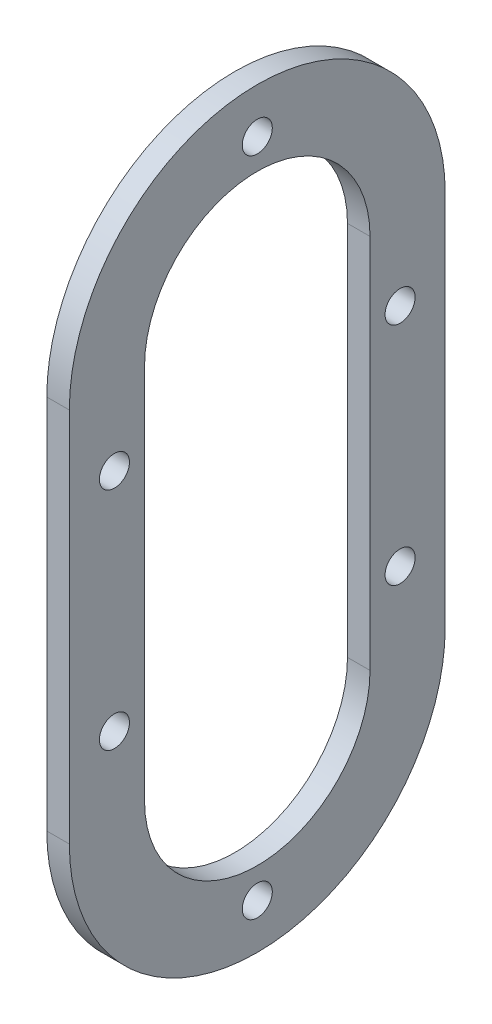
from build123d import *

# Parameters (mm, degrees)
SKETCH1_R           = 2
BOSS_EXTRUDE1_DEPTH = 3


with BuildPart() as part:
    # Sketch1 → Boss-Extrude1 (new body)
    with BuildSketch(Plane.YZ):
        with BuildLine():
            Line((0, 25), (50, 25))
            ThreePointArc((50, 25), (75, 0), (50, -25))
            Line((50, -25), (0, -25))
            ThreePointArc((0, -25), (-25, 0), (0, 25))
        make_face()
        with Locations(Location((10, 19, 0), (0, 0, 270))):
            Circle(SKETCH1_R, mode=Mode.SUBTRACT)
        with Locations(Location((40, 19, 0), (0, 0, 270))):
            Circle(SKETCH1_R, mode=Mode.SUBTRACT)
        with Locations(Location((69, 0, 0), (0, 0, 270))):
            Circle(SKETCH1_R, mode=Mode.SUBTRACT)
        with Locations(Location((-19, 0, 0), (0, 0, 270))):
            Circle(SKETCH1_R, mode=Mode.SUBTRACT)
        with Locations(Location((10, -19, 0), (0, 0, 270))):
            Circle(SKETCH1_R, mode=Mode.SUBTRACT)
        with Locations(Location((40, -19, 0), (0, 0, 270))):
            Circle(SKETCH1_R, mode=Mode.SUBTRACT)
        with BuildLine():
            Line((0, 15), (50, 15))
            ThreePointArc((50, 15), (65, 0), (50, -15))
            Line((50, -15), (0, -15))
            ThreePointArc((0, -15), (-15, 0), (0, 15))
        make_face(mode=Mode.SUBTRACT)
    extrude(amount=BOSS_EXTRUDE1_DEPTH)


solid = part.part
